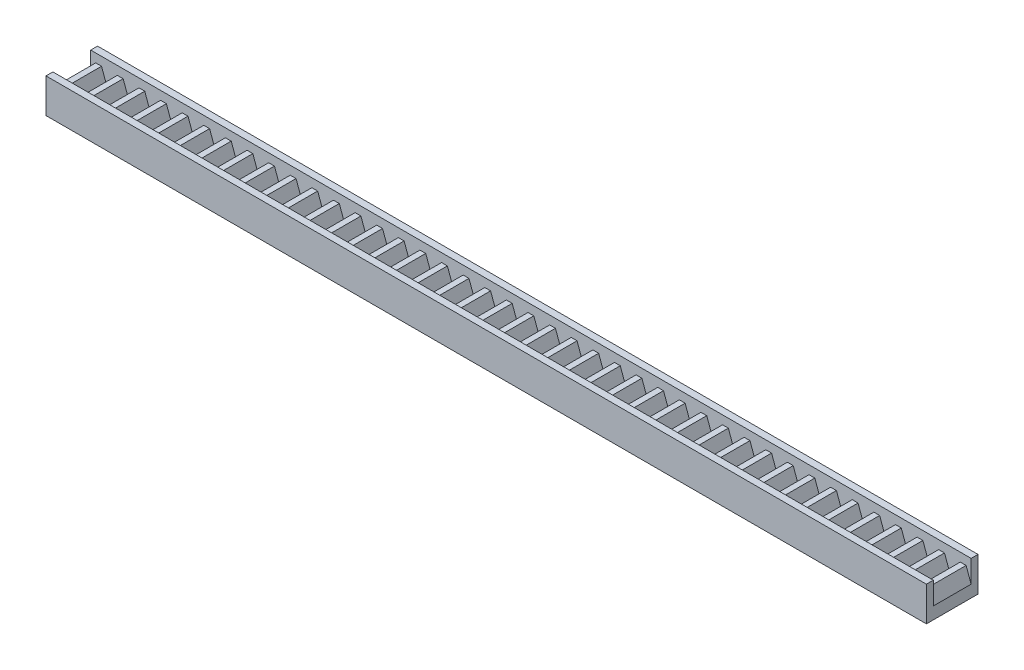
from build123d import *

# Parameters (mm, degrees)
SKETCH1_W           = 254
SKETCH1_H           = 3
BOSS_EXTRUDE1_DEPTH = 5.5
BOSS_EXTRUDE2_DEPTH = 11
LPATTERN2_COUNT     = 40
LPATTERN2_PITCH     = 6.2832
SKETCH7_W           = 255.925180937
SKETCH7_H           = 10
BOSS_EXTRUDE4_DEPTH = 2


with BuildPart() as part:
    # Sketch1 → Boss-Extrude1 (new, symmetric)
    with BuildSketch(Plane.XY):
        Rectangle(SKETCH1_W, SKETCH1_H)
    extrude(amount=BOSS_EXTRUDE1_DEPTH, both=True)

    # Sketch4 → Boss-Extrude2 (add)
    with BuildSketch(Plane.XY.offset(5.5)):
        with BuildLine():
            Line((-116.119619063, 1.5), (-116.119619063, 2))
            Line((-116.119619063, 2), (-117.5755, 6))
            Line((-117.5755, 6), (-119.261119063, 6))
            Line((-119.261119063, 6), (-120.717, 2))
            ThreePointArc((-120.717, 2), (-120.995212304, 1.637426666), (-121.431074003, 1.5))
            Line((-121.431074003, 1.5), (-121.68854506, 1.5))
            ThreePointArc((-121.68854506, 1.5), (-122.124406758, 1.637426666), (-122.402619063, 2))
            Line((-122.402619063, 2), (-123.8585, 6))
            Line((-123.8585, 6), (-125.544119063, 6))
            Line((-125.544119063, 6), (-127, 2))
            Line((-127, 2), (-127, 1.5))
            Line((-127, 1.5), (-127, -1.5))
            Line((-127, -1.5), (-116.119619063, -1.5))
            Line((-116.119619063, -1.5), (-116.119619063, 1.5))
        make_face()
    boss_extrude2 = extrude(amount=-BOSS_EXTRUDE2_DEPTH)

    # LPattern2: Boss-Extrude2 ×40
    with Locations(*[(i * LPATTERN2_PITCH, 0, 0) for i in range(1, LPATTERN2_COUNT)]):
        add(boss_extrude2)

    # Sketch7 → Boss-Extrude4 (add)
    with BuildSketch(Plane.XY.offset(5.5)):
        with Locations((0.962590469, 3.5)):
            Rectangle(SKETCH7_W, SKETCH7_H)
    boss_extrude4 = extrude(amount=BOSS_EXTRUDE4_DEPTH)

    # Mirror2: Boss-Extrude4 across plane
    add(boss_extrude4.mirror(Plane.XY))


solid = part.part
